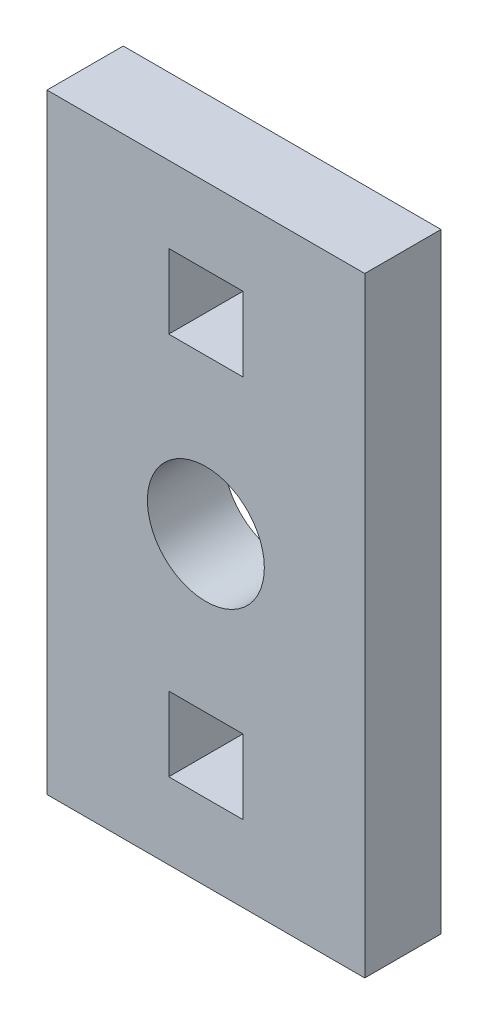
from build123d import *

# Parameters (mm, degrees)
SKETCH1_W           = 12.5
SKETCH1_H           = 24
SKETCH1_R           = 2.3
SKETCH1_W_2         = 2.92
SKETCH1_H_2         = 2.92
BOSS_EXTRUDE1_DEPTH = 3


with BuildPart() as part:
    # Sketch1 → Boss-Extrude1 (new body)
    with BuildSketch(Plane.XY):
        with Locations((-4.166666667, -4.095588235)):
            Rectangle(SKETCH1_W, SKETCH1_H)
        with Locations((-4.166666667, -4.095588235)):
            Circle(SKETCH1_R, mode=Mode.SUBTRACT)
        with Locations((-4.166666667, 3.444411765)):
            Rectangle(SKETCH1_W_2, SKETCH1_H_2, mode=Mode.SUBTRACT)
        with Locations((-4.166666667, -11.635588235)):
            Rectangle(SKETCH1_W_2, SKETCH1_H_2, mode=Mode.SUBTRACT)
    extrude(amount=BOSS_EXTRUDE1_DEPTH)


solid = part.part
